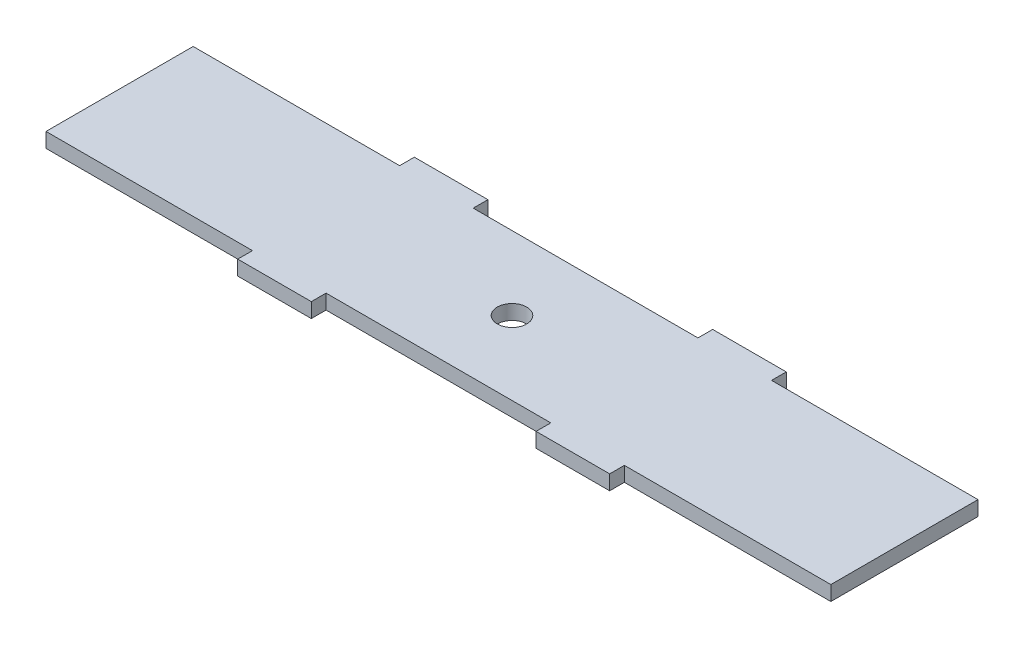
from build123d import *

# Parameters (mm, degrees)
SKETCH2_R           = 3
BOSS_EXTRUDE1_DEPTH = 3


with BuildPart() as part:
    # Sketch2 → Boss-Extrude1 (new body)
    with BuildSketch(Plane(origin=(0, 0, 0), x_dir=(1, 0, 0), z_dir=(0, 1, 0))):
        Polygon((0, 0), (42.09, 0), (42.09, 3), (57.09, 3), (57.09, 0), (102.91, 0), (102.91, 3), (117.91, 3), (117.91, 0), (160, 0), (160, -30), (117.91, -30), (117.91, -33), (102.91, -33), (102.91, -30), (57.09, -30), (57.09, -33), (42.09, -33), (42.09, -30), (0, -30), align=None)
        with Locations(Location((80, -15, 0), (0, 0, 270))):
            Circle(SKETCH2_R, mode=Mode.SUBTRACT)
    extrude(amount=BOSS_EXTRUDE1_DEPTH)


solid = part.part
